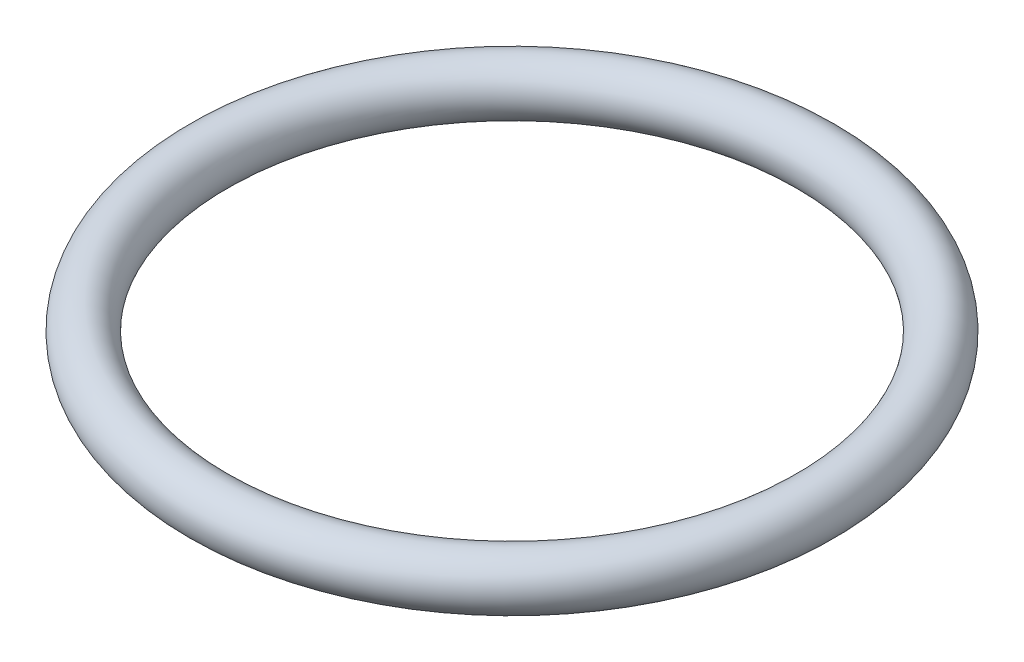
from build123d import *

# Parameters (mm, degrees)
SWEEP_1_PROFILE_R = 0.6


with BuildPart() as part:
    # 扫描1: sweep along a path in 草图1
    with BuildLine(Plane(origin=(0, 0, 0), x_dir=(1, 0, 0), z_dir=(0, 1, 0))) as sweep_1_path:
        CenterArc((0, 0), 6.9, 0, 360)
    # 扫描1 profile (on start of the path) → 扫描1 (sweep)
    with BuildSketch(Plane(origin=(6.9, 0, 0), x_dir=(-1, 0, 0), z_dir=(0, 0, -1))):
        Circle(SWEEP_1_PROFILE_R)
    sweep(path=sweep_1_path.line)


solid = part.part
